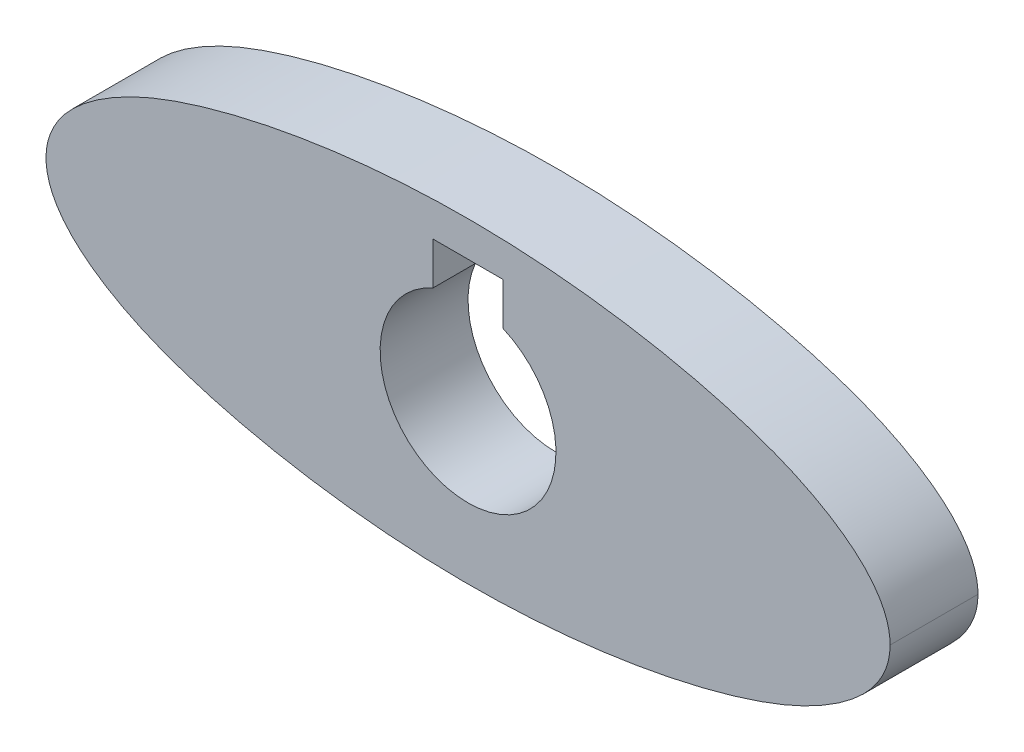
from build123d import *

# Parameters (mm, degrees)
CROQUIS1_R              = 5
SALIENTE_EXTRUIR1_DEPTH = 5
CORTAR_EXTRUIR1_DEPTH   = 27.11512986


with BuildPart() as part:
    # Croquis1 → Saliente-Extruir1 (new body)
    with BuildSketch(Plane(origin=(0, 0, 0), x_dir=(-1, 0, 0), z_dir=(0, 0, -1))):
        with BuildLine():
            add(Edge.make_bspline(
                [(24, 0), (24, 1.5), (23.04, 3.48), (15.36, 7.32), (8, 9), (-8, 9), (-15.36, 7.32), (-23.04, 3.48), (-24, 1.5), (-24, 0)],
                knots=[0, 0, 0, 0, 0.25, 0.25, 0.5, 0.5, 0.75, 0.75, 1, 1, 1, 1], degree=3))
            add(Edge.make_bspline(
                [(-24, 0), (-24, -1.5), (-23.04, -3.48), (-15.36, -7.32), (-8, -9), (8, -9), (15.36, -7.32), (23.04, -3.48), (24, -1.5), (24, 0)],
                knots=[0, 0, 0, 0, 0.25, 0.25, 0.5, 0.5, 0.75, 0.75, 1, 1, 1, 1], degree=3))
        make_face()
        with Locations(Location((0, 0, 0), (0, 0, 180))):
            Circle(CROQUIS1_R, mode=Mode.SUBTRACT)
    extrude(amount=-SALIENTE_EXTRUIR1_DEPTH)

    # Croquis3 → Cortar-Extruir1 (cut, through all)
    with BuildSketch(Plane.XY.offset(5)):
        with BuildLine():
            Line((-2, 4.582575695), (-2, 7))
            Line((-2, 7), (2, 7))
            Line((2, 7), (2, 4.582575695))
            ThreePointArc((2, 4.582575695), (0, 5), (-2, 4.582575695))
        make_face()
    extrude(amount=-CORTAR_EXTRUIR1_DEPTH, mode=Mode.SUBTRACT)


solid = part.part
